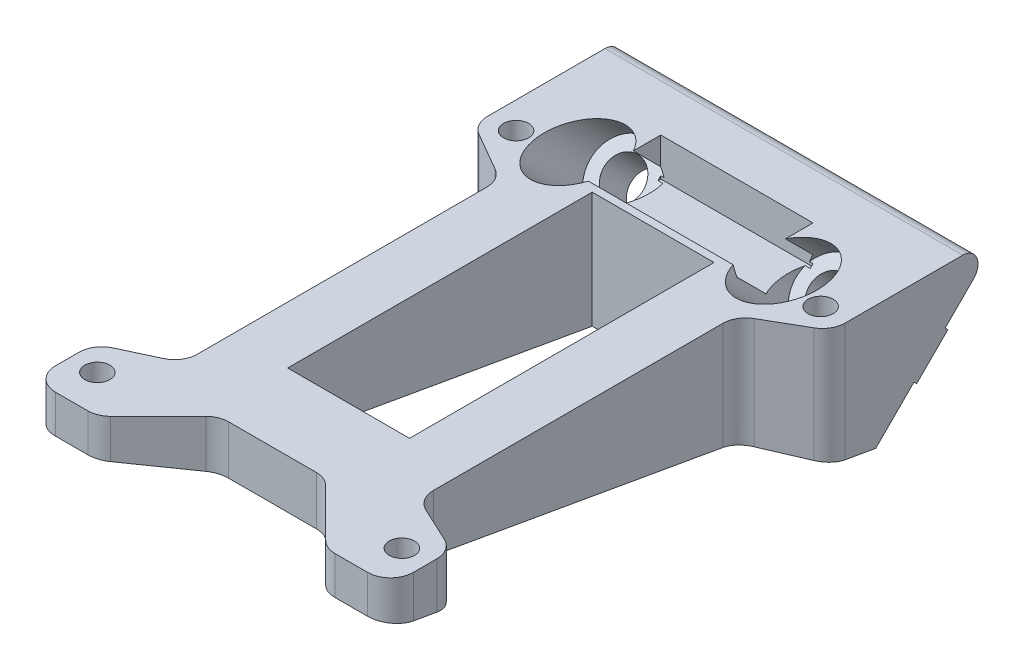
from build123d import *

# Parameters (mm, degrees)
EXTRUDE_2_DEPTH      = 5
EXTRUDE_3_DEPTH      = 23.5
SKETCH_3_R           = 1.65
CUT_EXTRUDE_1_DEPTH  = 85.951456727
CUT_EXTRUDE_5_REACH  = 89.951
CUT_EXTRUDE_START    = 3
SKETCH_8_R           = 3
CUT_EXTRUDE_10_REACH = 89.951
CUT_EXTRUDE_START_2  = -3
SKETCH_12_R          = 3
SKETCH_4_W           = 20
SKETCH_4_H           = 10
CUT_EXTRUDE_2_DEPTH  = 5
SKETCH_10_W          = 16
SKETCH_10_H          = 40
CUT_EXTRUDE_11_DEPTH = 85.951456727
FILLET_1_R           = 3
CUT_EXTRUDE_6_DEPTH  = 94.465851734
SKETCH_6_R           = 2.6
CUT_EXTRUDE_3_DEPTH  = 83.421182124
CUT_EXTRUDE_4_REACH  = 89.421
CUT_EXTRUDE_START_3  = -5
SKETCH_7_R           = 4.4
FILLET_3_R           = 2


with BuildPart() as part:
    # 草图2 → 凸台-拉伸2 (new body)
    with BuildSketch(Plane(origin=(0, 0, 0), x_dir=(1, 0, 0), z_dir=(0, 1, 0))):
        Polygon((0, 0), (23.5, 0), (23.5, -19), (23.5, -80), (0, -80), align=None)
    extrude_2 = extrude(amount=EXTRUDE_2_DEPTH)

    # 镜向1: 凸台-拉伸2 across plane
    add(extrude_2.mirror(Plane(origin=(0, 5, 80), x_dir=(0, 0, 1), z_dir=(1, 0, 0))))

    # 草图5 → 凸台-拉伸3 (add, symmetric)
    with BuildSketch(Plane(origin=(0, 0, 0), x_dir=(0, 0, -1), z_dir=(1, 0, 0))):
        Polygon((-80, 0), (-16.263455967, -11.263455967), (-11.242997821, -6.242997821), (-10.88944443, -6.596551211), (-6.788225099, -2.495331881), (-7.14177849, -2.14177849), (-5, 0), align=None)
    extrude(amount=EXTRUDE_3_DEPTH, both=True)

    # 草图3 → 切除-拉伸1 (cut, through all)
    with BuildSketch(Plane(origin=(0, 5, 0), x_dir=(1, 0, 0), z_dir=(0, 1, 0))):
        with Locations(Location((-20, -20, 0), (0, 0, 270))):
            Circle(SKETCH_3_R)
        with Locations(Location((20, -20, 0), (0, 0, 270))):
            Circle(SKETCH_3_R)
        with Locations(Location((-20, -75, 0), (0, 0, 270))):
            Circle(SKETCH_3_R)
        with Locations(Location((20, -75, 0), (0, 0, 270))):
            Circle(SKETCH_3_R)
    extrude(amount=-CUT_EXTRUDE_1_DEPTH, mode=Mode.SUBTRACT)

    # 切除-拉伸5: up to this plane
    cut_extrude_5_end = Plane(origin=(23.5, -13.709378738, 2.422707194), z_dir=(0, 0.9847416717466503, -0.174022527063632))
    # 草图8 → 切除-拉伸5 (cut, up to the surface)
    with BuildSketch(Plane.XZ.offset(-5).offset(CUT_EXTRUDE_START), mode=Mode.PRIVATE) as cut_extrude_5_sk1:
        with Locations(Location((-20, 20, 0), (0, 0, 90))):
            Circle(SKETCH_8_R)
    cut_extrude_5_tool1 = split(extrude(cut_extrude_5_sk1.sketch, amount=CUT_EXTRUDE_5_REACH, mode=Mode.PRIVATE), bisect_by=cut_extrude_5_end, keep=Keep.BOTH, mode=Mode.PRIVATE)
    add(cut_extrude_5_tool1.solids().sort_by_distance((-20, 2, 20))[0], mode=Mode.SUBTRACT)
    # 草图8 → 切除-拉伸5 (cut, up to the surface)
    with BuildSketch(Plane.XZ.offset(-5).offset(CUT_EXTRUDE_START), mode=Mode.PRIVATE) as cut_extrude_5_sk2:
        with Locations(Location((20, 20, 0), (0, 0, 90))):
            Circle(SKETCH_8_R)
    cut_extrude_5_tool2 = split(extrude(cut_extrude_5_sk2.sketch, amount=CUT_EXTRUDE_5_REACH, mode=Mode.PRIVATE), bisect_by=cut_extrude_5_end, keep=Keep.BOTH, mode=Mode.PRIVATE)
    add(cut_extrude_5_tool2.solids().sort_by_distance((20, 2, 20))[0], mode=Mode.SUBTRACT)

    # 切除-拉伸10: up to this plane
    cut_extrude_10_end = Plane(origin=(23.5, -13.709378738, 2.422707194), z_dir=(0, 0.9847416717466503, -0.174022527063632))
    # 草图12 → 切除-拉伸10 (cut, up to the surface)
    with BuildSketch(Plane(origin=(0, 5, 0), x_dir=(1, 0, 0), z_dir=(0, 1, 0)).offset(CUT_EXTRUDE_START_2), mode=Mode.PRIVATE) as cut_extrude_10_sk1:
        with Locations(Location((-20, -75, 0), (0, 0, 270))):
            Circle(SKETCH_12_R)
    cut_extrude_10_tool1 = split(extrude(cut_extrude_10_sk1.sketch, amount=-CUT_EXTRUDE_10_REACH, mode=Mode.PRIVATE), bisect_by=cut_extrude_10_end, keep=Keep.BOTH, mode=Mode.PRIVATE)
    add(cut_extrude_10_tool1.solids().sort_by_distance((-20, 2, 75))[0], mode=Mode.SUBTRACT)
    # 草图12 → 切除-拉伸10 (cut, up to the surface)
    with BuildSketch(Plane(origin=(0, 5, 0), x_dir=(1, 0, 0), z_dir=(0, 1, 0)).offset(CUT_EXTRUDE_START_2), mode=Mode.PRIVATE) as cut_extrude_10_sk2:
        with Locations(Location((20, -75, 0), (0, 0, 270))):
            Circle(SKETCH_12_R)
    cut_extrude_10_tool2 = split(extrude(cut_extrude_10_sk2.sketch, amount=-CUT_EXTRUDE_10_REACH, mode=Mode.PRIVATE), bisect_by=cut_extrude_10_end, keep=Keep.BOTH, mode=Mode.PRIVATE)
    add(cut_extrude_10_tool2.solids().sort_by_distance((20, 2, 75))[0], mode=Mode.SUBTRACT)

    # 草图4 → 切除-拉伸2 (cut)
    with BuildSketch(Plane(origin=(0, 5, 0), x_dir=(1, 0, 0), z_dir=(0, 1, 0))):
        with Locations((0, -16)):
            Rectangle(SKETCH_4_W, SKETCH_4_H)
    extrude(amount=-CUT_EXTRUDE_2_DEPTH, mode=Mode.SUBTRACT)

    # 草图10 → 切除-拉伸11 (cut, through all)
    with BuildSketch(Plane(origin=(0, 5, 0), x_dir=(1, 0, 0), z_dir=(0, 1, 0))):
        with Locations((0, -42)):
            Rectangle(SKETCH_10_W, SKETCH_10_H)
        Polygon((-7, -72), (-15, -80), (15, -80), (7, -72), align=None)
        Polygon((23.5, -22), (15.5, -26.618802154), (15.5, -68.269538735), (23.5, -72), align=None)
        Polygon((-15.5, -26.618802154), (-23.5, -22), (-23.5, -72), (-15.5, -68.269538735), align=None)
    extrude(amount=-CUT_EXTRUDE_11_DEPTH, mode=Mode.SUBTRACT)

    # 圆角1
    fillet_1_edges = [part.edges().sort_by_distance(p)[0] for p in [
        (-23.5, -2.624849927, 22),
        (-23.5, 1.793124148, 72),
        (23.5, 1.793124148, 72),
        (23.5, -2.624849927, 22),
        (15, 2.5, 80),
        (-15, 2.5, 80),
        (-15.5, -2.216734964, 26.618802154),
        (-15.5, 1.463502525, 68.269538735),
        (15.5, 1.463502525, 68.269538735),
        (15.5, -2.216734964, 26.618802154),
        (-7, 1.793124148, 72),
        (7, 1.793124148, 72),
        (-23.5, 2.5, 80),
        (23.5, 2.5, 80),
    ]]
    fillet(fillet_1_edges, radius=FILLET_1_R)

    # 草图9 → 切除-拉伸6 (cut, through all)
    with BuildSketch(Plane(origin=(23.5, 0, 0), x_dir=(0, 0, -1), z_dir=(1, 0, 0))):
        Polygon((-5, 0), (0, 5), (0, 0), align=None)
    extrude(amount=-CUT_EXTRUDE_6_DEPTH, mode=Mode.SUBTRACT)

    # 草图6 → 切除-拉伸3 (cut, through all)
    with BuildSketch(Plane(origin=(0, 2.146446609, 2.146446609), x_dir=(1, 0, 0), z_dir=(0, -0.7071067811865459, -0.7071067811865491))):
        with Locations(Location((-13.5, 9.464466094, 0), (0, 0, 270))):
            Circle(SKETCH_6_R)
        with Locations(Location((13.5, 9.464466094, 0), (0, 0, 270))):
            Circle(SKETCH_6_R)
    extrude(amount=-CUT_EXTRUDE_3_DEPTH, mode=Mode.SUBTRACT)

    # 草图7 → 切除-拉伸4 (cut, up to next)
    with BuildSketch(Plane(origin=(0, 2.146446609, 2.146446609), x_dir=(1, 0, 0), z_dir=(0, -0.7071067811865459, -0.7071067811865491)).offset(CUT_EXTRUDE_START_3), mode=Mode.PRIVATE) as cut_extrude_4_sk1:
        with Locations((-13.5, 9.464466094)):
            Circle(SKETCH_7_R)
    cut_extrude_4_tool1 = extrude(cut_extrude_4_sk1.sketch, amount=-CUT_EXTRUDE_4_REACH, mode=Mode.PRIVATE) & part.part
    # 草图7 → 切除-拉伸4 (cut, up to next)
    with BuildSketch(Plane(origin=(0, 2.146446609, 2.146446609), x_dir=(1, 0, 0), z_dir=(0, -0.7071067811865459, -0.7071067811865491)).offset(CUT_EXTRUDE_START_3), mode=Mode.PRIVATE) as cut_extrude_4_sk2:
        with Locations((13.5, 9.464466094)):
            Circle(SKETCH_7_R)
    cut_extrude_4_tool2 = extrude(cut_extrude_4_sk2.sketch, amount=-CUT_EXTRUDE_4_REACH, mode=Mode.PRIVATE) & part.part
    add(cut_extrude_4_tool1.solids().sort_by_distance((-13.5, -1.010408, 12.374369))[0], mode=Mode.SUBTRACT)
    add(cut_extrude_4_tool2.solids().sort_by_distance((13.5, -1.010408, 12.374369))[0], mode=Mode.SUBTRACT)

    # 圆角3
    fillet_3_edges = [part.edges().sort_by_distance(p)[0] for p in [
        (0, 5, 0),
    ]]
    fillet(fillet_3_edges, radius=FILLET_3_R)


solid = part.part
